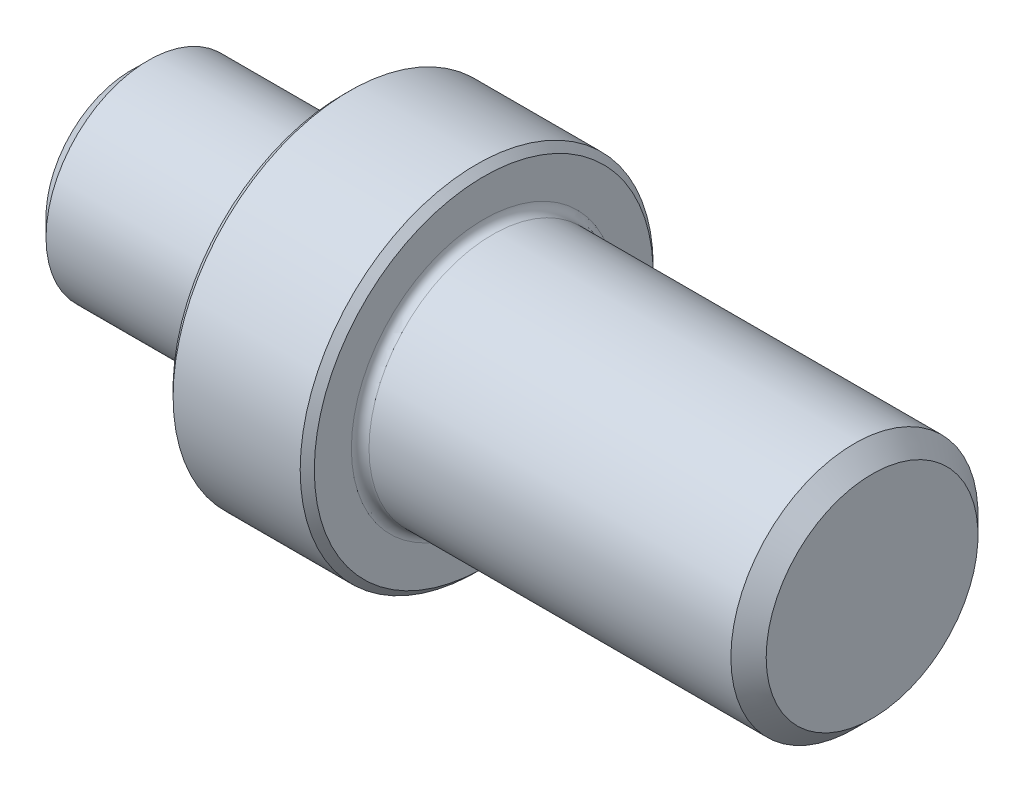
from build123d import *

# Parameters (mm, degrees)
CHAMFER1_SIZE = 5
CHAMFER2_SIZE = 2
FILLET1_R     = 2.5


with BuildPart() as part:
    # Sketch1 → Revolve1 (revolve)
    with BuildSketch(Plane.XY, mode=Mode.PRIVATE) as revolve1_sk:
        Polygon((0, 0), (0, 29), (60, 29), (60, 50), (100, 50), (100, 35), (210, 35), (210, 0), align=None)
    revolve(revolve1_sk.sketch.rotate(Axis((0, 0, 0), (1, 0, 0)), 90), axis=Axis((0, 0, 0), (1, 0, 0)))

    # Chamfer1
    chamfer1_edges = [part.edges().sort_by_distance(p)[0] for p in [
        (210, 0, -35),
        (0, 0, -29),
    ]]
    chamfer(chamfer1_edges, length=CHAMFER1_SIZE)

    # Chamfer2
    chamfer2_edges = [part.edges().sort_by_distance(p)[0] for p in [
        (100, 0, -50),
        (60, 0, -50),
    ]]
    chamfer(chamfer2_edges, length=CHAMFER2_SIZE)

    # Fillet1
    fillet1_edges = [part.edges().sort_by_distance(p)[0] for p in [
        (100, 0, -35),
        (60, 0, -29),
    ]]
    fillet(fillet1_edges, radius=FILLET1_R)


solid = part.part
